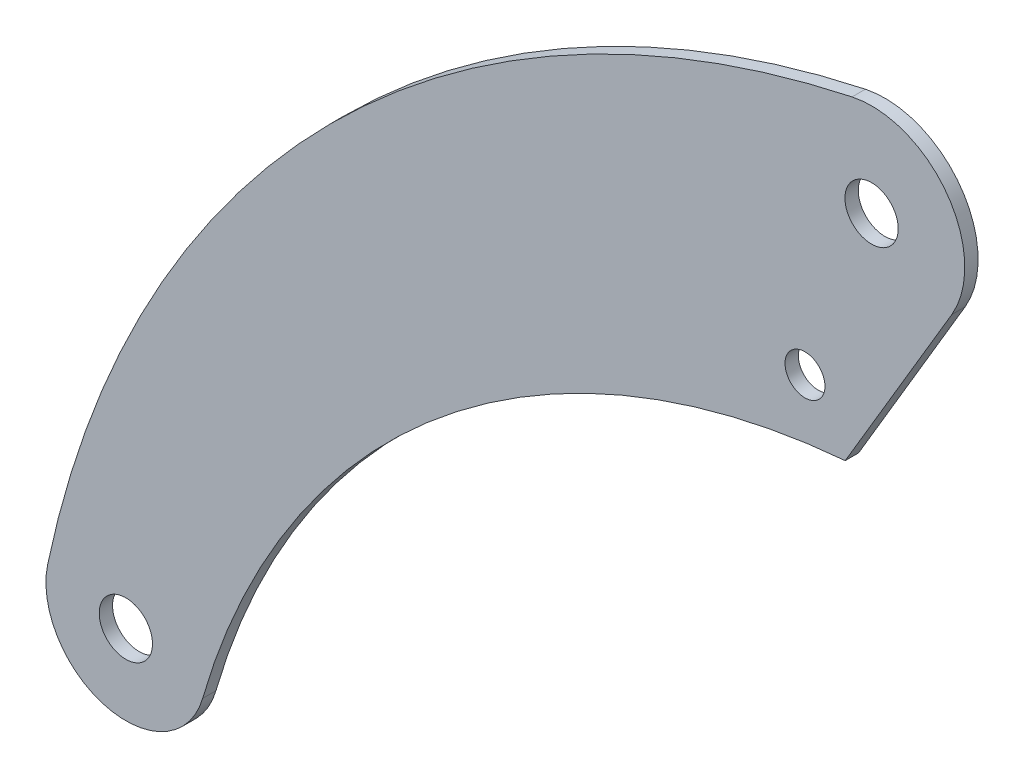
from build123d import *

# Parameters (mm, degrees)
SKETCH1_R           = 20
SKETCH1_R_2         = 15
BOSS_EXTRUDE1_DEPTH = 5


with BuildPart() as part:
    # Sketch1 → Boss-Extrude1 (new, symmetric)
    with BuildSketch(Plane.XY):
        with BuildLine():
            Line((60.220407354, -35.686167321), (-19.779592646, -170.686167321))
            ThreePointArc((-19.779592646, -170.686167321), (-322.664914871, -293.556077803), (-502.341900983, -566.599506551))
            ThreePointArc((-502.341900983, -566.599506551), (-574.483190404, -608.225743411), (-618.715737076, -537.652440745))
            ThreePointArc((-618.715737076, -537.652440745), (-406.524759245, -145.05016338), (-14.634584071, 68.45311497))
            ThreePointArc((-14.634584071, 68.45311497), (56.839813073, 40.856280421), (60.220407354, -35.686167321))
        make_face()
        Circle(SKETCH1_R, mode=Mode.SUBTRACT)
        with Locations((-50, -130)):
            Circle(SKETCH1_R_2, mode=Mode.SUBTRACT)
        with Locations((-560, -550)):
            Circle(SKETCH1_R, mode=Mode.SUBTRACT)
    extrude(amount=BOSS_EXTRUDE1_DEPTH, both=True)


solid = part.part
